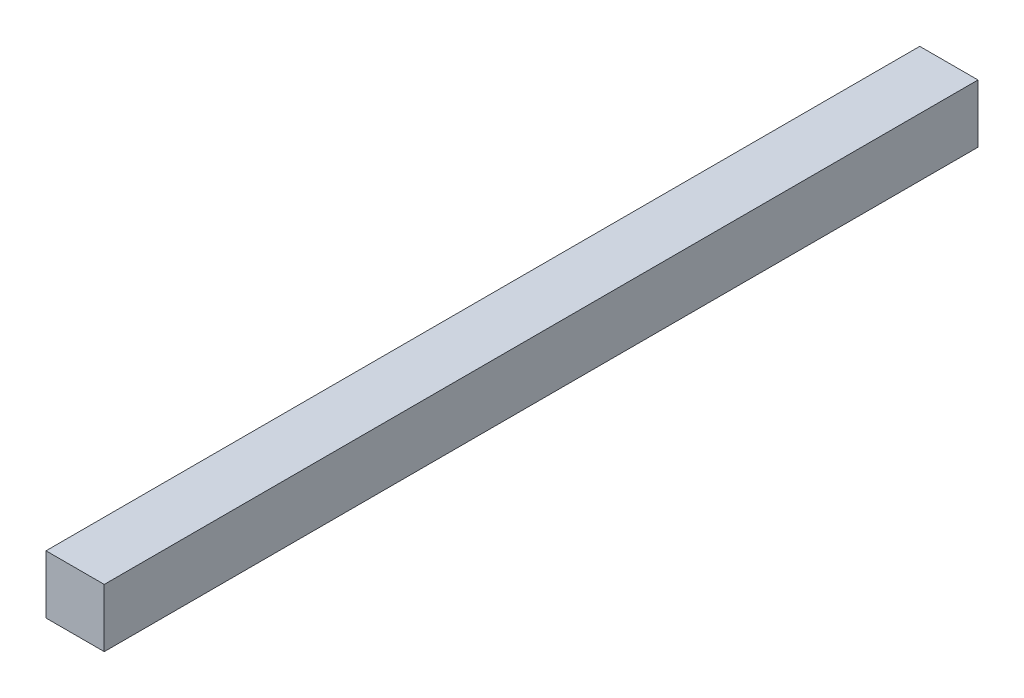
from build123d import *

# Parameters (mm, degrees)
SKETCH_1_W      = 20
SKETCH_1_H      = 20
EXTRUDE_1_DEPTH = 300


with BuildPart() as part:
    # Эскиз1 → Бобышка-Вытянуть1 (new body)
    with BuildSketch(Plane.XY):
        with Locations((10, 10)):
            Rectangle(SKETCH_1_W, SKETCH_1_H)
    extrude(amount=EXTRUDE_1_DEPTH)


solid = part.part
